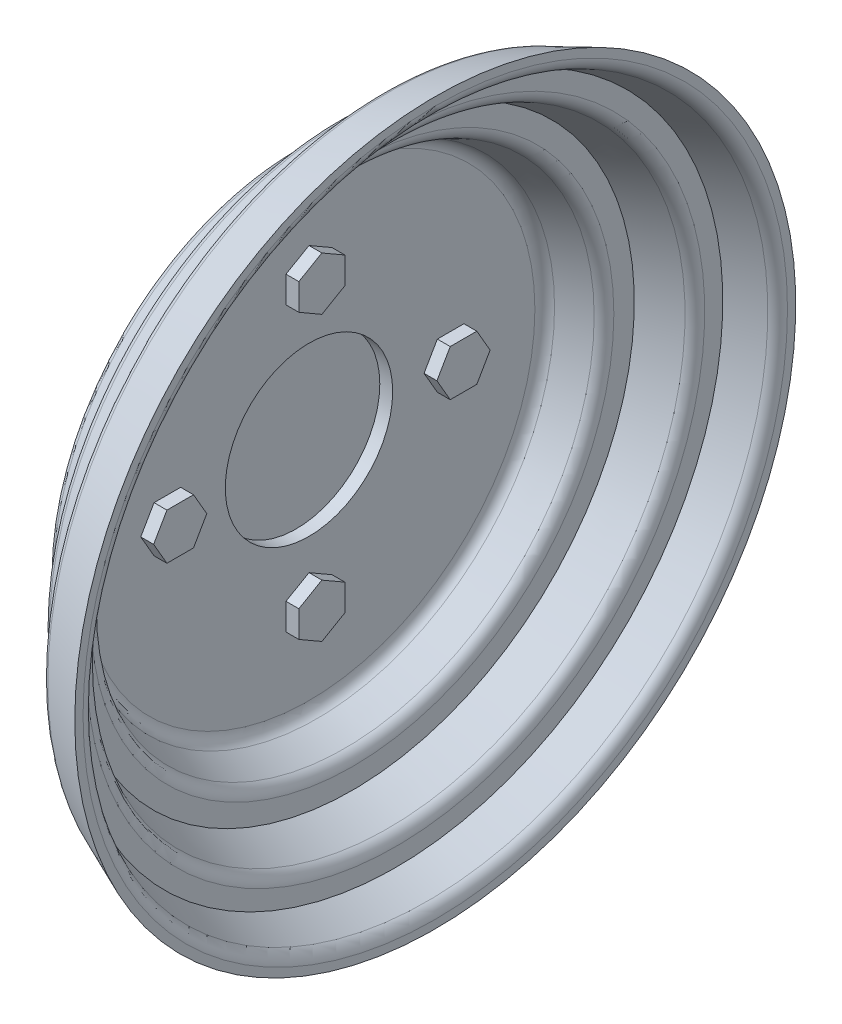
from build123d import *

# Parameters (mm, degrees)
VACIADO1_T              = -6
REDONDEO1_R             = 5
REDONDEO3_R             = 5
CROQUIS2_R              = 32.5
CORTAR_EXTRUIR1_DEPTH   = 5
SALIENTE_EXTRUIR1_DEPTH = 5


with BuildPart() as part:
    # Croquis1 → Revolución1 (revolve)
    with BuildSketch(Plane(origin=(0, 0, 0), x_dir=(1, 0, 0), z_dir=(0, 1, 0))):
        Polygon((48.737618848, 120.610275725), (31.868809424, 113.430137863), (31.868809424, 102.180137863), (15, 95), (15, 0), (70, 0), (70.03994637, 140), (48.737618848, 130.932753785), align=None)
    revolve(axis=Axis((-209.218950064, 0, 0), (1, 0, 0)))

    # Vaciado1
    vaciado1_openings = [part.faces().sort_by_distance(p)[0] for p in [
        (70.03994637, 0, 140),
    ]]
    offset(amount=VACIADO1_T, openings=vaciado1_openings, kind=Kind.INTERSECTION)

    # Redondeo1
    redondeo1_edges = [part.edges().sort_by_distance(p)[0] for p in [
        (37.868809424, 0, 98.213101948),
        (54.737618848, 0, 116.64323981),
        (70.038085524, 0, 133.478297231),
        (21, 0, 91.032964085),
    ]]
    fillet(redondeo1_edges, radius=REDONDEO1_R)

    # Redondeo3
    redondeo3_edges = [part.edges().sort_by_distance(p)[0] for p in [
        (15, 0, 95),
        (31.868809424, 0, 102.180137863),
        (31.868809424, 0, 113.430137863),
        (48.737618848, 0, 120.610275725),
        (48.737618848, 0, 130.932753785),
    ]]
    fillet(redondeo3_edges, radius=REDONDEO3_R)

    # Croquis2 → Cortar-Extruir1 (cut)
    with BuildSketch(Plane(origin=(21, 0, 0), x_dir=(0, 0, -1), z_dir=(1, 0, 0))):
        Circle(CROQUIS2_R)
    extrude(amount=-CORTAR_EXTRUIR1_DEPTH, mode=Mode.SUBTRACT)

    # Croquis2<3> → Saliente-Extruir1 (add)
    with BuildSketch(Plane(origin=(21, 0, 0), x_dir=(0, 0, -1), z_dir=(1, 0, 0))):
        Polygon((-8.93998744, -49.846872611), (-8.93998744, -60.169880921), (0, -65.331385076), (8.93998744, -60.169880921), (8.93998744, -49.846872611), (0, -44.685368456), align=None)
        Polygon((49.846872611, -8.93998744), (60.169880921, -8.93998744), (65.331385076, 0), (60.169880921, 8.93998744), (49.846872611, 8.93998744), (44.685368456, 0), align=None)
        Polygon((-49.846872611, 8.93998744), (-60.169880921, 8.93998744), (-65.331385076, 0), (-60.169880921, -8.93998744), (-49.846872611, -8.93998744), (-44.685368456, 0), align=None)
        Polygon((8.93998744, 49.846872611), (8.93998744, 60.169880921), (0, 65.331385076), (-8.93998744, 60.169880921), (-8.93998744, 49.846872611), (0, 44.685368456), align=None)
    extrude(amount=SALIENTE_EXTRUIR1_DEPTH)


solid = part.part
